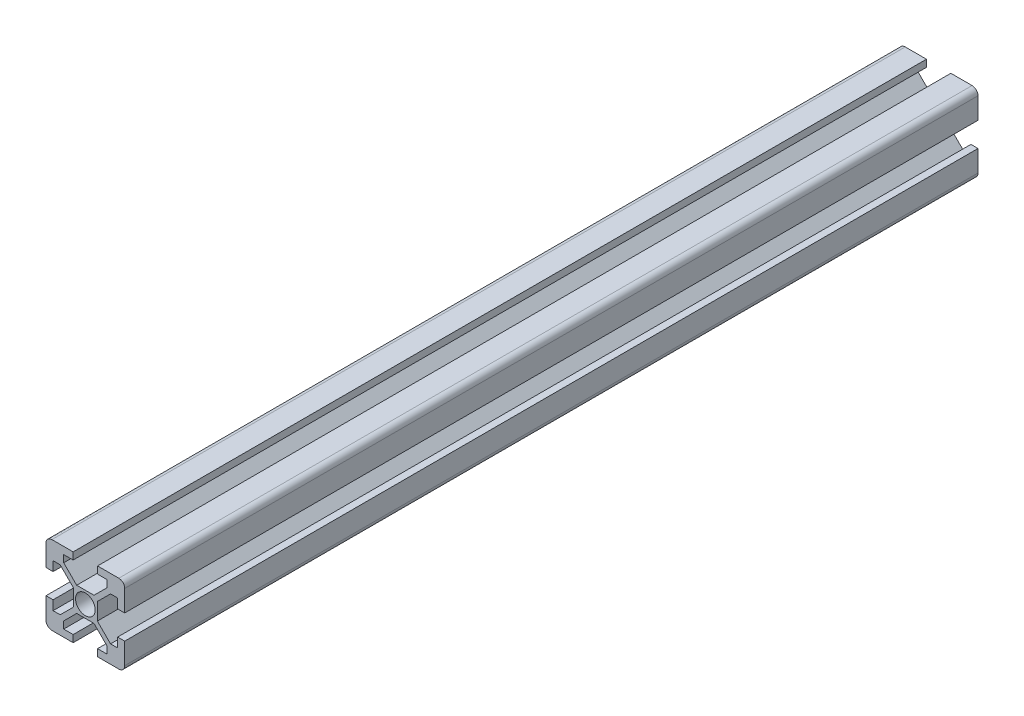
from build123d import *

# Parameters (mm, degrees)
SKETCH_2_R      = 2.5
EXTRUDE_1_DEPTH = 216.86


with BuildPart() as part:
    # 草图2 → 凸台-拉伸1 (new body)
    with BuildSketch(Plane.XY):
        with BuildLine():
            Line((-8.2, -3.1), (-10, -3.1))
            Line((-10, -3.1), (-10, -8.5))
            ThreePointArc((-10, -8.5), (-9.560660172, -9.560660172), (-8.5, -10))
            Line((-8.5, -10), (-3.1, -10))
            Line((-3.1, -10), (-3.1, -8.2))
            Line((-3.1, -8.2), (-5.5, -8.2))
            Line((-5.5, -8.2), (-5.5, -6.397050155))
            Line((-5.5, -6.397050155), (-2.202949845, -3.1))
            Line((-2.202949845, -3.1), (2.202949845, -3.1))
            Line((2.202949845, -3.1), (5.5, -6.397050155))
            Line((5.5, -6.397050155), (5.5, -8.2))
            Line((5.5, -8.2), (3.1, -8.2))
            Line((3.1, -8.2), (3.1, -10))
            Line((3.1, -10), (8.5, -10))
            ThreePointArc((8.5, -10), (9.560660172, -9.560660172), (10, -8.5))
            Line((10, -8.5), (10, -3.1))
            Line((10, -3.1), (8.2, -3.1))
            Line((8.2, -3.1), (8.2, -5.5))
            Line((8.2, -5.5), (6.397050155, -5.5))
            Line((6.397050155, -5.5), (3.05412702, -2.157076865))
            Line((3.05412702, -2.157076865), (3.05412702, 2.157076865))
            Line((3.05412702, 2.157076865), (6.397050155, 5.5))
            Line((6.397050155, 5.5), (8.2, 5.5))
            Line((8.2, 5.5), (8.2, 3.1))
            Line((8.2, 3.1), (10, 3.1))
            Line((10, 3.1), (10, 8.5))
            ThreePointArc((10, 8.5), (9.560660172, 9.560660172), (8.5, 10))
            Line((8.5, 10), (3.1, 10))
            Line((3.1, 10), (3.1, 8.2))
            Line((3.1, 8.2), (5.5, 8.2))
            Line((5.5, 8.2), (5.5, 6.397050155))
            Line((5.5, 6.397050155), (2.202949845, 3.1))
            Line((2.202949845, 3.1), (-2.202949845, 3.1))
            Line((-2.202949845, 3.1), (-5.5, 6.397050155))
            Line((-5.5, 6.397050155), (-5.5, 8.2))
            Line((-5.5, 8.2), (-3.1, 8.2))
            Line((-3.1, 8.2), (-3.1, 10))
            Line((-3.1, 10), (-8.5, 10))
            ThreePointArc((-8.5, 10), (-9.560660172, 9.560660172), (-10, 8.5))
            Line((-10, 8.5), (-10, 3.1))
            Line((-10, 3.1), (-8.2, 3.1))
            Line((-8.2, 3.1), (-8.2, 5.5))
            Line((-8.2, 5.5), (-6.397050155, 5.5))
            Line((-6.397050155, 5.5), (-3.05412702, 2.157076865))
            Line((-3.05412702, 2.157076865), (-3.05412702, -2.157076865))
            Line((-3.05412702, -2.157076865), (-6.397050155, -5.5))
            Line((-6.397050155, -5.5), (-8.2, -5.5))
            Line((-8.2, -5.5), (-8.2, -3.1))
        make_face()
        Circle(SKETCH_2_R, mode=Mode.SUBTRACT)
    extrude(amount=EXTRUDE_1_DEPTH)


solid = part.part
